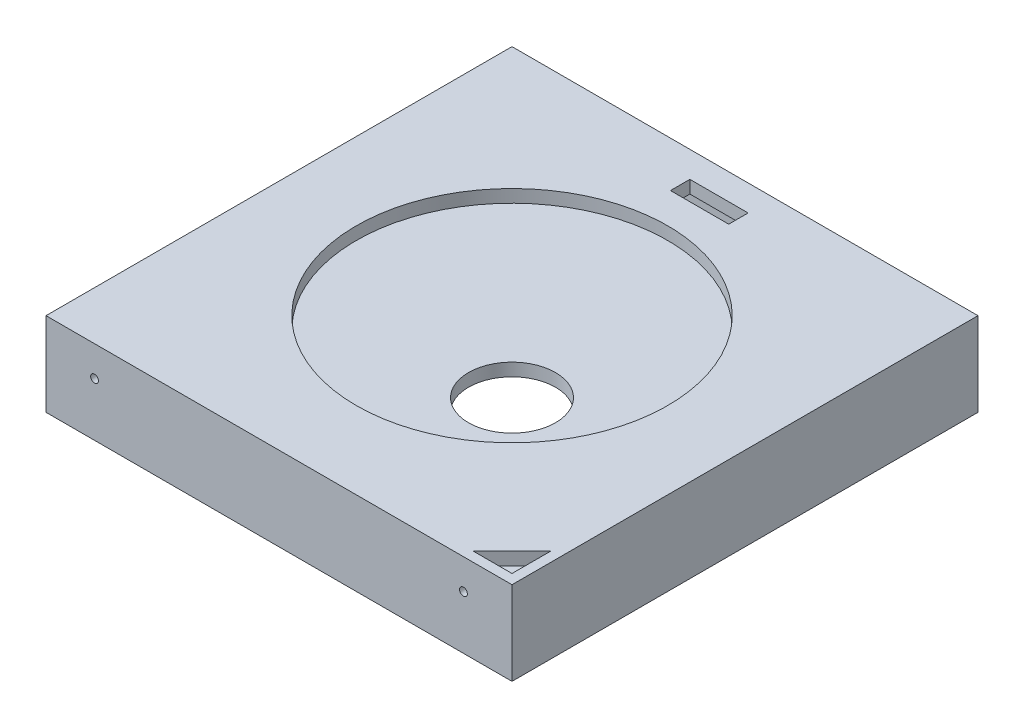
from build123d import *

# Parameters (mm, degrees)
SKETCH1_W               = 304.8
SKETCH1_H               = 304.8
BOSS_EXTRUDE1_DEPTH     = 54.77002
SKETCH2_R               = 101.854
SKETCH2_W               = 38.1
SKETCH2_H               = 12.7
CUT_EXTRUDE3_DEPTH      = 38.1
SKETCH3_R               = 2.54
CUT_EXTRUDE4_DEPTH      = 31.75
CUT_EXTRUDE5_DEPTH      = 19.05
CUT_EXTRUDE5_DEPTH_BACK = 19.05
SKETCH4_W               = 292.1
SKETCH4_H               = 292.1
SKETCH5_R               = 28.448
CUT_EXTRUDE6_DEPTH      = 273.928796473


with BuildPart() as part:
    # Sketch1 → Boss-Extrude1 (new body)
    with BuildSketch(Plane(origin=(0, 0, 0), x_dir=(1, 0, 0), z_dir=(0, 1, 0))):
        with Locations((13.737464789, -57.096338028)):
            Rectangle(SKETCH1_W, SKETCH1_H)
    extrude(amount=BOSS_EXTRUDE1_DEPTH)

    # Sketch2 → Cut-Extrude3 (cut)
    with BuildSketch(Plane(origin=(0, 54.77002, 0), x_dir=(1, 0, 0), z_dir=(0, 1, 0))):
        with Locations(Location((13.737464789, -57.096338028, 0), (0, 0, 270))):
            Circle(SKETCH2_R)
        Polygon((134.387464789, -203.146338028), (159.787464789, -203.146338028), (159.787464789, -177.746338028), align=None)
        with Locations((13.737464789, 71.941420767)):
            Rectangle(SKETCH2_W, SKETCH2_H)
    extrude(amount=-CUT_EXTRUDE3_DEPTH, mode=Mode.SUBTRACT)

    # Sketch3 → Cut-Extrude4 (cut)
    with BuildSketch(Plane.XY.offset(209.496338028)):
        with Locations((134.387464789, 34.95802)):
            Circle(SKETCH3_R)
        with Locations((-106.912535211, 34.95802)):
            Circle(SKETCH3_R)
    extrude(amount=-CUT_EXTRUDE4_DEPTH, mode=Mode.SUBTRACT)

    # Sketch4 → Cut-Extrude5 (cut, two sides: drawn at the far end of the back side and taken through both)
    with BuildSketch(Plane(origin=(0, 27.38501, 0), x_dir=(1, 0, 0), z_dir=(0, 1, 0)).offset(-CUT_EXTRUDE5_DEPTH_BACK)):
        with Locations((13.737464789, -57.096338028)):
            Rectangle(SKETCH4_W, SKETCH4_H)
    extrude(amount=CUT_EXTRUDE5_DEPTH + CUT_EXTRUDE5_DEPTH_BACK, mode=Mode.SUBTRACT)

    # Sketch5 → Cut-Extrude6 (cut, through all)
    with BuildSketch(Plane.XZ):
        with Locations(Location((13.737464789, 57.096338028, 0), (0, 0, 270))):
            Circle(SKETCH5_R)
    extrude(amount=-CUT_EXTRUDE6_DEPTH, mode=Mode.SUBTRACT)


solid = part.part
